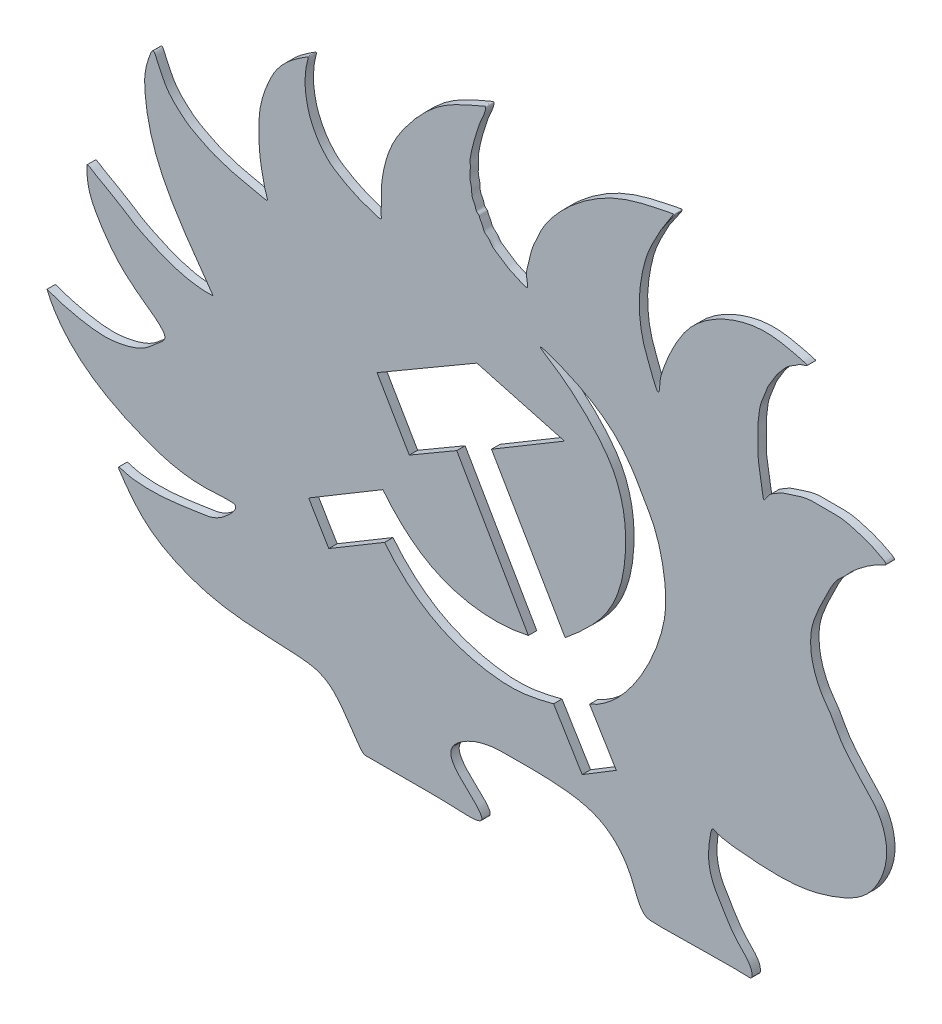
from build123d import *

# Parameters (mm, degrees)
EXTRUDE_1_DEPTH = 4


with BuildPart() as part:
    # Эскиз2 → Бобышка-Вытянуть1 (new body)
    with BuildSketch(Plane.XY):
        with BuildLine():
            add(Edge.make_bspline(
                [(79.186403569, 153.363303991), (67.243617663, 170.638565994), (50.581335502, 190.90878701), (46.034863615, 223.849026031), (46.831761116, 232.1463826), (50.385202638, 241.349511454), (52.092920875, 238.24235588), (53.108427021, 235.790329428), (54.874409685, 231.889639428), (57.157797024, 227.609461887), (60.365882757, 223.924710938), (63.655980666, 220.979562248), (66.670560612, 218.440299115), (70.506944812, 216.171137773), (74.649380381, 214.172410864), (79.269230977, 211.85824958), (83.965573041, 210.478052718), (88.298538191, 208.951361136), (92.738727328, 208.121752352), (97.362581844, 206.861088018), (101.556711136, 206.1245671), (105.503538693, 205.211740416), (104.034728068, 208.766847156), (102.971503848, 213.631045003), (101.196178628, 221.936081718), (100.927768873, 231.274312124), (100.99894299, 241.980893986), (104.003021865, 251.559852669), (109.93422744, 264.364761585), (117.020849428, 270.151159176), (124.640791067, 274.761286103), (123.661869405, 271.312563241), (123.225565656, 268.78205649), (122.7281604, 263.306529855), (123.309532646, 258.042071404), (124.238101561, 253.242022358), (125.673359968, 249.039845009), (127.372561822, 245.582095303), (129.247178718, 242.194179044), (131.702951477, 239.184835031), (134.325599631, 236.3674817), (136.978047786, 234.334693714), (139.532019181, 233.016679899), (141.983836914, 231.332345766), (145.15945314, 229.913765298), (148.603517814, 228.113309222), (152.349443691, 226.974279143), (155.125343615, 225.99624835), (159.99427209, 224.278920458), (158.833069706, 227.512195021), (159.463213092, 230.287140342), (159.057493504, 237.034276676), (159.827973146, 244.060421501), (163.146978138, 257.654906659), (172.047884763, 271.396543525), (187.009917427, 287.297913906), (199.765850997, 292.529583515), (209.256420747, 296.604675465), (208.395766267, 292.818724625), (206.933011336, 290.340050862), (204.887236301, 284.651568021), (203.388667039, 279.552959597), (202.250361483, 274.832761874), (201.410808274, 270.561449793), (201.944345669, 267.362098168), (201.038386551, 263.232264961), (202.529572266, 259.499960714), (202.102367509, 255.823242651), (204.111903362, 253.406146119), (204.306312981, 250.871848451), (205.884220403, 250.196437043), (206.153162788, 248.653264252), (207.479574769, 247.041165501), (208.028293821, 244.170583444), (210.780629228, 242.678949132), (211.97161102, 240.211828707), (213.915083187, 239.039174936), (215.715894921, 237.800215175), (217.632791044, 236.58943025), (219.812457004, 234.993829852), (222.437523024, 233.967776115), (224.891536895, 232.647134003), (226.845273128, 232.135080888), (229.814431994, 230.72212218), (227.685685188, 237.077168493), (229.615156402, 241.562676626), (230.397639022, 247.365310931), (232.804230801, 253.051716956), (235.643464014, 259.52207784), (245.24731793, 273.446268344), (267.123166402, 290.327399977), (285.533329597, 294.406166093), (298.652668862, 296.871914278), (298.528404539, 296.288690653), (298.316812514, 295.578898486), (296.967626715, 294.381696023), (295.533253149, 291.758158199), (292.504511888, 287.58523395), (289.360079135, 281.416832031), (285.812850316, 274.273253247), (283.490498964, 265.412821728), (281.972051467, 255.499760239), (282.144952719, 245.553349209), (284.138591397, 235.745135569), (286.510372642, 230.190037507), (291.684167614, 215.848919885), (291.960106281, 225.233164549), (293.716898728, 231.372821448), (298.715149616, 243.392820031), (310.506935275, 261.438011557), (336.857198006, 272.602305475), (352.81611607, 268.996919897), (363.400622527, 266.123751705), (358.741371941, 265.20520495), (356.627542317, 263.259170159), (352.951555007, 261.565226617), (350.408614142, 258.31357602), (347.682943894, 255.445028325), (345.930903073, 251.923981224), (343.469089243, 248.642637713), (342.25940668, 244.556178289), (340.4954102, 240.92901825), (339.458269667, 237.395235412), (339.282867871, 234.17144167), (338.534576198, 230.499471247), (338.917391031, 227.030704092), (338.504148169, 222.976391214), (338.826008248, 219.437181746), (338.67629828, 216.094203883), (339.341935775, 213.00430045), (339.692141555, 209.942891306), (340.405680948, 206.138263552), (340.896618512, 203.68697405), (341.280573467, 198.952184616), (343.578561212, 203.640203139), (346.158203136, 205.367399865), (350.139942107, 207.754198428), (355.04974648, 209.182537854), (359.531382614, 210.774001159), (364.104424296, 211.475942492), (368.539162782, 211.280514961), (372.926209042, 211.290479694), (377.890325033, 211.433770266), (382.371316624, 210.584086548), (387.095694046, 209.172569441), (392.234914035, 207.448189158), (395.523516394, 205.794635504), (401.10900257, 202.907512551), (397.648545066, 201.694703644), (395.641976717, 200.666507198), (393.141733965, 199.27554563), (390.18952363, 197.279481583), (386.940100877, 194.792810106), (383.422432865, 192.031689172), (380.416501481, 188.293865231), (375.0667903, 184.120498611), (371.841099071, 176.837809895), (368.062079091, 169.607638046), (365.463828048, 163.421426767), (364.049760468, 158.320374782), (363.729606767, 153.131096501), (363.885752057, 148.890376336), (365.405001314, 141.301663988), (368.291276661, 134.567978783), (374.308157158, 127.013798707), (376.795874563, 120.671167012), (382.788463546, 113.466341117), (388.649436388, 106.788505931), (395.701131189, 100.052503189), (399.821812762, 90.603483891), (400.426170433, 80.467660445), (396.898492381, 70.127623411), (389.983277512, 60.455408611), (377.67343953, 53.942530151), (359.133746245, 48.241732016), (339.835242073, 48.758873268), (320.488795218, 50.616411766), (316.468940306, 53.360664718), (315.274871164, 44.62092465), (314.90515958, 38.879172321), (316.572671758, 30.583678047), (322.79356739, 20.796545836), (327.218648843, 12.950177283), (333.800918061, 7.269155651), (335.862296255, 3.238768436), (336.044149424, -0.333546972), (328.535598269, 0.512169191), (294.763782112, -0.683882073), (282.908989825, 0.065986377), (278.113321755, 17.06532213), (264.894510557, 31.565104706), (242.011722218, 34.142349993), (221.111104966, 34.189565363), (204.30504788, 34.122190159), (188.991747373, 22.657486165), (197.550558259, 12.205644443), (204.223522271, 6.907277929), (210.364421503, -1.829227049), (195.416286452, 0.000556254), (178.979809833, 0.014516779), (154.733088341, 0.270150149), (148.882317333, -0.42182038), (137.934725532, 23.38051959), (110.520242805, 26.100710494), (82.410742898, 25.584710266), (50.886525958, 38.622682262), (41.054622504, 49.285599101), (33.274397603, 60.864170904), (38.495578581, 59.076355659), (43.411323767, 58.324790471), (56.11403683, 57.901862835), (72.568283967, 60.872932453), (81.781737432, 61.494932277), (89.871423597, 70.234633304), (90.225538629, 72.517722258), (86.85221947, 72.805447737), (82.126712496, 72.684059031), (75.242210045, 72.14599235), (66.394787961, 72.696642232), (56.392763162, 74.506273894), (43.235732967, 79.287595225), (21.023572775, 89.478486772), (5.561016325, 103.252603525), (0, 116.524913915)],
                knots=[0, 0, 0, 0, 0.041085617, 0.052158956, 0.060568742, 0.063132457, 0.064246031, 0.066067749, 0.068891982, 0.072463076, 0.07569043, 0.078455137, 0.081196439, 0.083454237, 0.087235664, 0.090291048, 0.093634801, 0.096884704, 0.099351621, 0.102544628, 0.106336643, 0.107797317, 0.109004669, 0.112017231, 0.118546272, 0.125075312, 0.131235343, 0.139350755, 0.14483153, 0.158543329, 0.158825952, 0.159965245, 0.162481231, 0.166155338, 0.169771376, 0.173192173, 0.175730285, 0.17852883, 0.180794231, 0.18336051, 0.186176129, 0.188388009, 0.18991653, 0.191845838, 0.194248139, 0.196764125, 0.199540462, 0.201830412, 0.203950089, 0.205283223, 0.206904474, 0.210053108, 0.216375532, 0.223634597, 0.236280326, 0.248892758, 0.265233964, 0.265550129, 0.267049831, 0.26953781, 0.273177142, 0.277820839, 0.281536618, 0.282756136, 0.285124736, 0.288271175, 0.290649608, 0.292904621, 0.295151858, 0.296600094, 0.297384449, 0.298169425, 0.29946842, 0.301483355, 0.303536298, 0.30520387, 0.306704685, 0.307907188, 0.309544469, 0.311181749, 0.313210712, 0.315120792, 0.316534201, 0.317515096, 0.320312836, 0.324090044, 0.328278311, 0.331793088, 0.336233122, 0.34220796, 0.36521057, 0.386070985, 0.386260187, 0.386512456, 0.386911329, 0.387896472, 0.389803151, 0.392899236, 0.398008078, 0.403483324, 0.408594501, 0.416050861, 0.423116934, 0.428583819, 0.434349221, 0.440159977, 0.442721007, 0.446073674, 0.455677524, 0.466537746, 0.489358526, 0.503487783, 0.504255496, 0.506542833, 0.50814982, 0.51102076, 0.513912157, 0.51630034, 0.518783454, 0.521631882, 0.524328562, 0.527096591, 0.529658782, 0.53136909, 0.533924489, 0.5364987, 0.538935776, 0.541616134, 0.54377383, 0.545575197, 0.548069197, 0.550190987, 0.552183384, 0.554030662, 0.556126544, 0.558371496, 0.561443954, 0.564457525, 0.568672086, 0.570739272, 0.573582878, 0.57730178, 0.579926467, 0.582920568, 0.586552456, 0.589723767, 0.593093319, 0.595750519, 0.597112192, 0.598495623, 0.600618055, 0.602596659, 0.605589928, 0.608624486, 0.611665598, 0.614736435, 0.621970834, 0.626842194, 0.630964734, 0.63519858, 0.637208758, 0.641223163, 0.643515118, 0.652579366, 0.6544325, 0.662046462, 0.666714469, 0.672218411, 0.679393222, 0.685358507, 0.691735456, 0.69859914, 0.706180979, 0.714128924, 0.725131165, 0.742957557, 0.7541994, 0.755987137, 0.760834929, 0.767315922, 0.775252996, 0.781748306, 0.793447145, 0.801373484, 0.804331094, 0.80627232, 0.807833423, 0.818596715, 0.820550959, 0.826030451, 0.836371931, 0.846534288, 0.854622852, 0.864011607, 0.869488466, 0.8740111, 0.878503494, 0.881105467, 0.888702489, 0.890515231, 0.898264256, 0.900099476, 0.90789881, 0.913333999, 0.92719733, 0.935771867, 0.944449564, 0.945031609, 0.945894785, 0.947838033, 0.951297308, 0.957664654, 0.963274705, 0.964013666, 0.965054264, 0.965586065, 0.966859859, 0.970093336, 0.972240638, 0.975714163, 0.980145162, 0.986134551, 1, 1, 1, 1], degree=3))
            add(Edge.make_bspline(
                [(0, 116.524913915), (5.591504686, 114.395204768), (14.672060946, 112.033896533), (27.151940937, 110.342623388), (37.080774516, 111.616394534), (46.45300966, 114.676927099), (51.665866095, 119.936203837), (57.667049788, 124.469542022), (52.848587539, 129.745376314), (46.008272234, 134.529610707), (35.424957952, 142.403537512), (26.96434955, 153.466254955), (20.055022159, 165.215093428), (18.990184575, 172.14106266), (18.953561356, 177.793301731), (20.924681788, 176.905043088), (22.5313045, 175.648421087), (26.319856146, 173.724860607), (31.123492282, 170.844651676), (36.111267621, 167.98771659), (41.814561752, 164.104545376), (53.37863329, 158.427965902), (66.036423782, 152.705805002), (79.186403569, 153.363303991)],
                knots=[0, 0, 0, 0, 0.092822107, 0.146646054, 0.194250465, 0.249260328, 0.292260393, 0.318432478, 0.343121901, 0.381235121, 0.458872204, 0.54096117, 0.601000449, 0.66158076, 0.665809921, 0.672219992, 0.684963756, 0.703311959, 0.735440065, 0.772065164, 0.799686517, 0.822480001, 1, 1, 1, 1], degree=3))
        make_face()
        with BuildLine():
            add(Edge.make_bspline(
                [(160.844021232, 92.524335729), (167.966418567, 83.515733346), (182.233822048, 71.301633438), (205.370857172, 64.044756365), (223.919743207, 61.922473577), (235.623575793, 64.686539819), (241.357370857, 66.164537291)],
                knots=[0, 0, 0, 0, 0.384908306, 0.604542947, 0.801571286, 1, 1, 1, 1], degree=3))
            Line((241.357370857, 66.164537291), (254.976303319, 43.78303588))
            Line((254.976303319, 43.78303588), (271.218110246, 53.66602217))
            Line((271.218110246, 53.66602217), (258.489486219, 74.584381036))
            add(Edge.make_bspline(
                [(258.489486219, 74.584381036), (276.86264476, 82.180299518), (292.622419506, 112.703714143), (295.659220671, 140.028468907), (292.021731976, 159.594813581), (279.875763222, 179.32121412), (271.831068688, 197.97540413), (229.228721959, 213.227783655), (245.292157114, 203.420616177), (255.788366138, 194.571184444), (273.157227775, 176.087371395), (277.523327573, 147.961948026), (270.921632373, 117.060602203), (254.934564318, 102.877488165), (246.848107105, 96.209136804)],
                knots=[0, 0, 0, 0, 0.188800111, 0.214777547, 0.314344655, 0.342772716, 0.48661227, 0.549175702, 0.568983603, 0.628941384, 0.703403786, 0.801802283, 0.895928504, 1, 1, 1, 1], degree=3))
            Line((246.848107105, 96.209136804), (211.756228355, 156.418272022))
            Line((211.756228355, 156.418272022), (246.529873506, 177.155252431))
            Line((246.529873506, 177.155252431), (204.785595356, 188.451222085))
            Line((204.785595356, 188.451222085), (157.245535292, 160.743300065))
            Line((157.245535292, 160.743300065), (172.60110708, 134.396870888))
            Line((172.60110708, 134.396870888), (195.203141701, 147.570085477))
            Line((195.203141701, 147.570085477), (229.342460592, 88.342443887))
            add(Edge.make_bspline(
                [(229.342460592, 88.342443887), (213.831569795, 84.777730066), (185.592633213, 87.371486244), (165.954706768, 106.411455972), (160.021749611, 113.848077778)],
                knots=[0, 0, 0, 0, 0.620455653, 1, 1, 1, 1], degree=3))
            Line((160.021749611, 113.848077778), (124.654912389, 92.757352103))
            Line((124.654912389, 92.757352103), (134.25098251, 76.665793417))
            Line((134.25098251, 76.665793417), (160.844021232, 92.524335729))
        make_face(mode=Mode.SUBTRACT)
    extrude(amount=EXTRUDE_1_DEPTH)


solid = part.part
